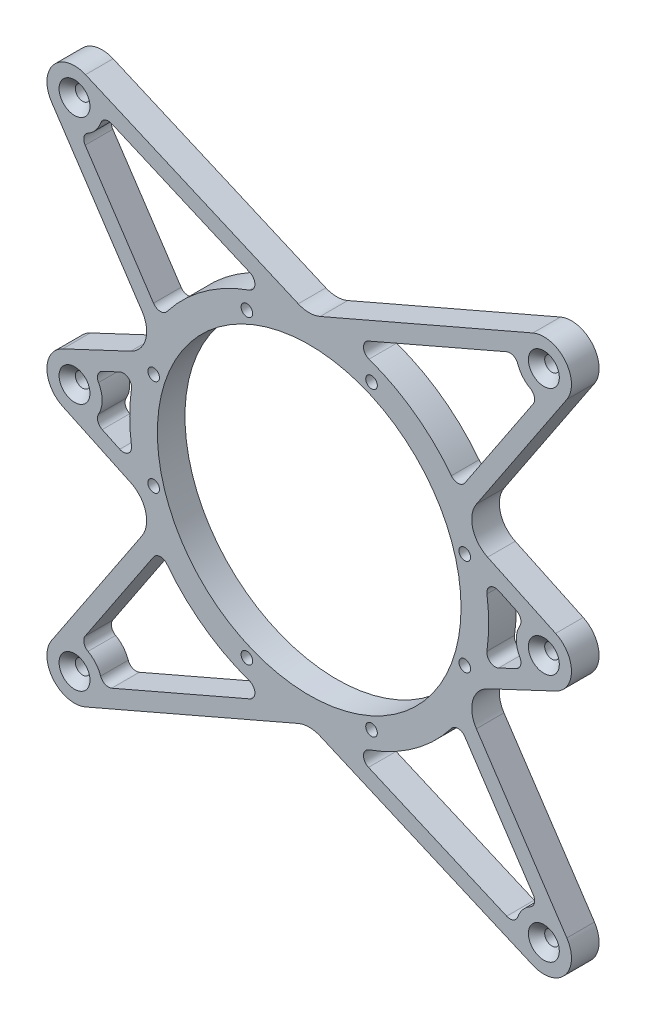
from build123d import *

# Parameters (mm, degrees)
SKETCH_1_R                   = 55
SKETCH_1_R_2                 = 2.6
SKETCH_1_R_3                 = 2.1
EXTRUDE_1_DEPTH              = 10
EXTRUDE_START                = -10
SKETCH_2_R                   = 2.6
EXTRUDE_3_DEPTH              = 10
CUT_EXTRUDE_1_DEPTH          = 30
FILLET_1_R                   = 3
HOLE_WIZARD_M5_1_D           = 5.3
HOLE_WIZARD_M5_1_DEPTH       = 22.4
HOLE_WIZARD_M5_1_CSINK_D     = 11.2
HOLE_WIZARD_M5_1_CSINK_ANGLE = 90
HOLE_WIZARD_M5_1_TIP         = 1.59228064
HOLE_WIZARD_M5_2_D           = 5.3
HOLE_WIZARD_M5_2_DEPTH       = 22.4
HOLE_WIZARD_M5_2_CSINK_D     = 11.2
HOLE_WIZARD_M5_2_CSINK_ANGLE = 90
HOLE_WIZARD_M5_2_TIP         = 1.59228064


with BuildPart() as part:
    # 草图1 → 凸台-拉伸1 (new body)
    with BuildSketch(Plane.XY):
        with BuildLine():
            ThreePointArc((-80.637921085, 94.119741198), (-89.119741198, 94.362078915), (-89.362078915, 85.880258802))
            Line((-89.362078915, 85.880258802), (-48.802059886, 42.9343563))
            ThreePointArc((-48.802059886, 42.9343563), (-59.690805099, 25.729511978), (-64.722484501, 6))
            Line((-64.722484501, 6), (-85, 6))
            ThreePointArc((-85, 6), (-91, 0), (-85, -6))
            Line((-85, -6), (-64.722484501, -6))
            ThreePointArc((-64.722484501, -6), (-59.690805099, -25.729511978), (-48.802059886, -42.9343563))
            Line((-48.802059886, -42.9343563), (-89.362078915, -85.880258802))
            ThreePointArc((-89.362078915, -85.880258802), (-89.119741198, -94.362078915), (-80.637921085, -94.119741198))
            Line((-80.637921085, -94.119741198), (-40.077902055, -51.173838696))
            ThreePointArc((-40.077902055, -51.173838696), (0, -65), (40.077902055, -51.173838696))
            Line((40.077902055, -51.173838696), (80.637921085, -94.119741198))
            ThreePointArc((80.637921085, -94.119741198), (89.119741198, -94.362078915), (89.362078915, -85.880258802))
            Line((89.362078915, -85.880258802), (48.802059886, -42.9343563))
            ThreePointArc((48.802059886, -42.9343563), (59.690805099, -25.729511978), (64.722484501, -6))
            Line((64.722484501, -6), (85, -6))
            ThreePointArc((85, -6), (91, 0), (85, 6))
            Line((85, 6), (64.722484501, 6))
            ThreePointArc((64.722484501, 6), (59.690805099, 25.729511978), (48.802059886, 42.9343563))
            Line((48.802059886, 42.9343563), (89.362078915, 85.880258802))
            ThreePointArc((89.362078915, 85.880258802), (89.119741198, 94.362078915), (80.637921085, 94.119741198))
            Line((80.637921085, 94.119741198), (40.077902055, 51.173838696))
            ThreePointArc((40.077902055, 51.173838696), (0, 65), (-40.077902055, 51.173838696))
            Line((-40.077902055, 51.173838696), (-80.637921085, 94.119741198))
        make_face()
        Circle(SKETCH_1_R, mode=Mode.SUBTRACT)
        with Locations((-85, 90)):
            Circle(SKETCH_1_R_2, mode=Mode.SUBTRACT)
        with Locations((-56.344919913, 17.5)):
            Circle(SKETCH_1_R_3, mode=Mode.SUBTRACT)
        with Locations((22.57832251, 54.508892418)):
            Circle(SKETCH_1_R_3, mode=Mode.SUBTRACT)
        with Locations((-22.57832251, 54.508892418)):
            Circle(SKETCH_1_R_3, mode=Mode.SUBTRACT)
        with Locations((-85, 0)):
            Circle(SKETCH_1_R_2, mode=Mode.SUBTRACT)
        with Locations((-56.344919913, -17.5)):
            Circle(SKETCH_1_R_3, mode=Mode.SUBTRACT)
        with Locations((85, 90)):
            Circle(SKETCH_1_R_2, mode=Mode.SUBTRACT)
        with Locations((56.344919913, 17.5)):
            Circle(SKETCH_1_R_3, mode=Mode.SUBTRACT)
        with Locations((-85, -90)):
            Circle(SKETCH_1_R_2, mode=Mode.SUBTRACT)
        with Locations((22.57832251, -54.508892418)):
            Circle(SKETCH_1_R_3, mode=Mode.SUBTRACT)
        with Locations((-22.57832251, -54.508892418)):
            Circle(SKETCH_1_R_3, mode=Mode.SUBTRACT)
        with Locations((85, 0)):
            Circle(SKETCH_1_R_2, mode=Mode.SUBTRACT)
        with Locations((56.344919913, -17.5)):
            Circle(SKETCH_1_R_3, mode=Mode.SUBTRACT)
        with Locations((85, -90)):
            Circle(SKETCH_1_R_2, mode=Mode.SUBTRACT)
    extrude(amount=EXTRUDE_1_DEPTH)

    # 草图2 → 凸台-拉伸3 (add)
    # profile 1 of 24: a face of its own
    with BuildSketch(Plane.XY.offset(10).offset(EXTRUDE_START)):
        with BuildLine():
            Line((-3.97243513, 65.822867597), (-81.02756487, 99.177132403))
            ThreePointArc((-81.02756487, 99.177132403), (-76.641640373, 95.489792742), (-75, 90))
            ThreePointArc((-75, 90), (-75.036299086, 89.148727949), (-75.144932821, 88.303635977))
            Line((-75.144932821, 88.303635977), (-40.077902055, 51.173838696))
            ThreePointArc((-40.077902055, 51.173838696), (-21.197882984, 61.446316057), (-3.1e-08, 65))
            ThreePointArc((-3.1e-08, 65), (-2.028383111, 65.207877556), (-3.97243513, 65.822867597))
        make_face()
    # profile 2 of 24: a face of its own
    with BuildSketch(Plane.XY.offset(10).offset(EXTRUDE_START)):
        with BuildLine():
            ThreePointArc((3.97243513, 65.822867597), (2.028383081, 65.20787755), (-3.1e-08, 65))
            ThreePointArc((-3.1e-08, 65), (21.197882955, 61.446316067), (40.077902055, 51.173838696))
            Line((40.077902055, 51.173838696), (75.144932821, 88.303635977))
            ThreePointArc((75.144932821, 88.303635977), (76.204649742, 94.758341502), (81.02756487, 99.177132403))
            Line((81.02756487, 99.177132403), (3.97243513, 65.822867597))
        make_face()
    # profile 3 of 24: a face of its own
    with BuildSketch(Plane.XY.offset(10).offset(EXTRUDE_START)):
        with BuildLine():
            ThreePointArc((-83.869090652, 80.064153582), (-89.214676132, 80.931565455), (-93.324194568, 84.458539471))
            Line((-93.324194568, 84.458539471), (-60.550698091, 35.22730162))
            ThreePointArc((-60.550698091, 35.22730162), (-59.303008161, 32.58049602), (-58.874892659, 29.685841091))
            ThreePointArc((-58.874892659, 29.685841091), (-59.081190839, 27.665097497), (-59.691573593, 25.727729049))
            ThreePointArc((-59.691573593, 25.727729049), (-54.924804339, 34.760118934), (-48.802059886, 42.9343563))
            Line((-48.802059886, 42.9343563), (-83.869090652, 80.064153582))
        make_face()
    # profile 4 of 24: a face of its own
    with BuildSketch(Plane.XY.offset(10).offset(EXTRUDE_START)):
        with BuildLine():
            ThreePointArc((-75, 90), (-76.641640373, 95.489792742), (-81.02756487, 99.177132403))
            ThreePointArc((-81.02756487, 99.177132403), (-92.674222894, 96.411419732), (-93.324194568, 84.458539471))
            ThreePointArc((-93.324194568, 84.458539471), (-89.214676132, 80.931565455), (-83.869090652, 80.064153582))
            Line((-83.869090652, 80.064153582), (-89.362078915, 85.880258802))
            ThreePointArc((-89.362078915, 85.880258802), (-89.119741198, 94.362078915), (-80.637921085, 94.119741198))
            Line((-80.637921085, 94.119741198), (-75.144932821, 88.303635977))
            ThreePointArc((-75.144932821, 88.303635977), (-75.036299086, 89.148727949), (-75, 90))
        make_face()
    # profile 5 of 24: a face of its own
    with BuildSketch(Plane.XY.offset(10).offset(EXTRUDE_START)):
        with BuildLine():
            ThreePointArc((-83.869090652, 80.064153582), (-78.13376467, 82.729868475), (-75.144932821, 88.303635977))
            Line((-75.144932821, 88.303635977), (-80.637921085, 94.119741198))
            ThreePointArc((-80.637921085, 94.119741198), (-89.119741198, 94.362078915), (-89.362078915, 85.880258802))
            Line((-89.362078915, 85.880258802), (-83.869090652, 80.064153582))
        make_face()
        with Locations((-85, 90)):
            Circle(SKETCH_2_R, mode=Mode.SUBTRACT)
    # profile 6 of 24: a face of its own
    with BuildSketch(Plane.XY.offset(10).offset(EXTRUDE_START)):
        with BuildLine():
            ThreePointArc((-59.691573593, 25.727729049), (-61.689227382, 22.731258822), (-64.618822759, 20.636759977))
            Line((-64.618822759, 20.636759977), (-89.256069899, 9.049081114))
            ThreePointArc((-89.256069899, 9.049081114), (-82.585776096, 9.704201304), (-77, 6))
            Line((-77, 6), (-64.722484501, 6))
            ThreePointArc((-64.722484501, 6), (-62.984206641, 16.062058206), (-59.691573593, 25.727729049))
        make_face()
    # profile 7 of 24: a face of its own
    with BuildSketch(Plane.XY.offset(10).offset(EXTRUDE_START)):
        with BuildLine():
            ThreePointArc((-77, -6), (-82.585776096, -9.704201304), (-89.256069899, -9.049081114))
            Line((-89.256069899, -9.049081114), (-64.618822759, -20.636759977))
            ThreePointArc((-64.618822759, -20.636759977), (-61.689227425, -22.731258778), (-59.691573641, -25.727728936))
            ThreePointArc((-59.691573641, -25.727728936), (-62.984206656, -16.062058146), (-64.722484501, -6))
            Line((-64.722484501, -6), (-77, -6))
        make_face()
    # profile 8 of 24: a face of its own
    with BuildSketch(Plane.XY.offset(10).offset(EXTRUDE_START)):
        with BuildLine():
            ThreePointArc((-77, 6), (-82.585776096, 9.704201304), (-89.256069899, 9.049081114))
            ThreePointArc((-89.256069899, 9.049081114), (-95, 0), (-89.256069899, -9.049081114))
            ThreePointArc((-89.256069899, -9.049081114), (-82.585776096, -9.704201304), (-77, -6))
            Line((-77, -6), (-85, -6))
            ThreePointArc((-85, -6), (-91, 0), (-85, 6))
            Line((-85, 6), (-77, 6))
        make_face()
    # profile 9 of 24: a face of its own
    with BuildSketch(Plane.XY.offset(10).offset(EXTRUDE_START)):
        with BuildLine():
            ThreePointArc((-75, 0), (-75.513167019, 3.16227766), (-77, 6))
            Line((-77, 6), (-85, 6))
            ThreePointArc((-85, 6), (-91, 0), (-85, -6))
            Line((-85, -6), (-77, -6))
            ThreePointArc((-77, -6), (-75.513167019, -3.16227766), (-75, 0))
        make_face()
        with Locations((-85, 0)):
            Circle(SKETCH_2_R, mode=Mode.SUBTRACT)
    # profile 10 of 24: a face of its own
    with BuildSketch(Plane.XY.offset(10).offset(EXTRUDE_START)):
        with BuildLine():
            ThreePointArc((-58.874892659, -29.685841091), (-59.303008161, -32.58049602), (-60.550698091, -35.22730162))
            Line((-60.550698091, -35.22730162), (-93.324194568, -84.458539471))
            ThreePointArc((-93.324194568, -84.458539471), (-89.214676132, -80.931565455), (-83.869090652, -80.064153582))
            Line((-83.869090652, -80.064153582), (-48.802059886, -42.9343563))
            ThreePointArc((-48.802059886, -42.9343563), (-54.924804372, -34.760118882), (-59.691573641, -25.727728936))
            ThreePointArc((-59.691573641, -25.727728936), (-59.081190851, -27.665097437), (-58.874892659, -29.685841091))
        make_face()
    # profile 11 of 24: a face of its own
    with BuildSketch(Plane.XY.offset(10).offset(EXTRUDE_START)):
        with BuildLine():
            ThreePointArc((-83.869090652, -80.064153582), (-89.214676132, -80.931565455), (-93.324194568, -84.458539471))
            ThreePointArc((-93.324194568, -84.458539471), (-92.674222894, -96.411419732), (-81.02756487, -99.177132403))
            ThreePointArc((-81.02756487, -99.177132403), (-76.641640373, -95.489792742), (-75, -90))
            ThreePointArc((-75, -90), (-75.036299086, -89.148727949), (-75.144932821, -88.303635977))
            Line((-75.144932821, -88.303635977), (-80.637921085, -94.119741198))
            ThreePointArc((-80.637921085, -94.119741198), (-89.119741198, -94.362078915), (-89.362078915, -85.880258802))
            Line((-89.362078915, -85.880258802), (-83.869090652, -80.064153582))
        make_face()
    # profile 12 of 24: a face of its own
    with BuildSketch(Plane.XY.offset(10).offset(EXTRUDE_START)):
        with BuildLine():
            ThreePointArc((-75.144932821, -88.303635977), (-78.13376467, -82.729868475), (-83.869090652, -80.064153582))
            Line((-83.869090652, -80.064153582), (-89.362078915, -85.880258802))
            ThreePointArc((-89.362078915, -85.880258802), (-89.119741198, -94.362078915), (-80.637921085, -94.119741198))
            Line((-80.637921085, -94.119741198), (-75.144932821, -88.303635977))
        make_face()
        with Locations((-85, -90)):
            Circle(SKETCH_2_R, mode=Mode.SUBTRACT)
    # profile 13 of 24: a face of its own
    with BuildSketch(Plane.XY.offset(10).offset(EXTRUDE_START)):
        with BuildLine():
            ThreePointArc((-75, -90), (-76.641640373, -95.489792742), (-81.02756487, -99.177132403))
            Line((-81.02756487, -99.177132403), (-3.97243513, -65.822867597))
            ThreePointArc((-3.97243513, -65.822867597), (-2.028383123, -65.207877559), (-5.3e-08, -65))
            ThreePointArc((-5.3e-08, -65), (-21.197882995, -61.446316053), (-40.077902055, -51.173838696))
            Line((-40.077902055, -51.173838696), (-75.144932821, -88.303635977))
            ThreePointArc((-75.144932821, -88.303635977), (-75.036299086, -89.148727949), (-75, -90))
        make_face()
    # profile 14 of 24: a face of its own
    with BuildSketch(Plane.XY.offset(10).offset(EXTRUDE_START)):
        with BuildLine():
            ThreePointArc((40.077902055, -51.173838696), (21.197882944, -61.446316071), (-5.3e-08, -65))
            ThreePointArc((-5.3e-08, -65), (2.02838307, -65.207877548), (3.97243513, -65.822867597))
            Line((3.97243513, -65.822867597), (81.02756487, -99.177132403))
            ThreePointArc((81.02756487, -99.177132403), (76.204649742, -94.758341502), (75.144932821, -88.303635977))
            Line((75.144932821, -88.303635977), (40.077902055, -51.173838696))
        make_face()
    # profile 15 of 24: a face of its own
    with BuildSketch(Plane.XY.offset(10).offset(EXTRUDE_START)):
        with BuildLine():
            ThreePointArc((75.144932821, -88.303635977), (76.204649742, -94.758341502), (81.02756487, -99.177132403))
            ThreePointArc((81.02756487, -99.177132403), (90.489792742, -98.358359627), (95, -90))
            ThreePointArc((95, -90), (94.571884498, -87.105345071), (93.324194568, -84.458539471))
            ThreePointArc((93.324194568, -84.458539471), (89.214676132, -80.931565455), (83.869090652, -80.064153582))
            Line((83.869090652, -80.064153582), (89.362078915, -85.880258802))
            ThreePointArc((89.362078915, -85.880258802), (89.119741198, -94.362078915), (80.637921085, -94.119741198))
            Line((80.637921085, -94.119741198), (75.144932821, -88.303635977))
        make_face()
    # profile 16 of 24: a face of its own
    with BuildSketch(Plane.XY.offset(10).offset(EXTRUDE_START)):
        with BuildLine():
            ThreePointArc((83.869090652, -80.064153582), (78.13376467, -82.729868475), (75.144932821, -88.303635977))
            Line((75.144932821, -88.303635977), (80.637921085, -94.119741198))
            ThreePointArc((80.637921085, -94.119741198), (89.119741198, -94.362078915), (89.362078915, -85.880258802))
            Line((89.362078915, -85.880258802), (83.869090652, -80.064153582))
        make_face()
        with Locations((85, -90)):
            Circle(SKETCH_2_R, mode=Mode.SUBTRACT)
    # profile 17 of 24: a face of its own
    with BuildSketch(Plane.XY.offset(10).offset(EXTRUDE_START)):
        with BuildLine():
            ThreePointArc((60.550698091, -35.22730162), (58.915538859, -30.586547422), (59.691573565, -25.727729112))
            ThreePointArc((59.691573565, -25.727729112), (54.924804321, -34.760118963), (48.802059886, -42.9343563))
            Line((48.802059886, -42.9343563), (83.869090652, -80.064153582))
            ThreePointArc((83.869090652, -80.064153582), (89.214676132, -80.931565455), (93.324194568, -84.458539471))
            Line((93.324194568, -84.458539471), (60.550698091, -35.22730162))
        make_face()
    # profile 18 of 24: a face of its own
    with BuildSketch(Plane.XY.offset(10).offset(EXTRUDE_START)):
        with BuildLine():
            ThreePointArc((89.256069899, -9.049081114), (82.585776096, -9.704201304), (77, -6))
            Line((77, -6), (64.722484501, -6))
            ThreePointArc((64.722484501, -6), (62.984206633, -16.062058239), (59.691573565, -25.727729112))
            ThreePointArc((59.691573565, -25.727729112), (61.689227358, -22.731258847), (64.618822759, -20.636759977))
            Line((64.618822759, -20.636759977), (89.256069899, -9.049081114))
        make_face()
    # profile 19 of 24: a face of its own
    with BuildSketch(Plane.XY.offset(10).offset(EXTRUDE_START)):
        with BuildLine():
            ThreePointArc((95, 0), (93.442769066, 5.359071795), (89.256069899, 9.049081114))
            ThreePointArc((89.256069899, 9.049081114), (82.585776096, 9.704201304), (77, 6))
            Line((77, 6), (85, 6))
            ThreePointArc((85, 6), (91, 0), (85, -6))
            Line((85, -6), (77, -6))
            ThreePointArc((77, -6), (82.585776096, -9.704201304), (89.256069899, -9.049081114))
            ThreePointArc((89.256069899, -9.049081114), (93.442769066, -5.359071795), (95, 0))
        make_face()
    # profile 20 of 24: a face of its own
    with BuildSketch(Plane.XY.offset(10).offset(EXTRUDE_START)):
        with BuildLine():
            Line((85, 6), (77, 6))
            ThreePointArc((77, 6), (75, 0), (77, -6))
            Line((77, -6), (85, -6))
            ThreePointArc((85, -6), (91, 0), (85, 6))
        make_face()
        with Locations((85, 0)):
            Circle(SKETCH_2_R, mode=Mode.SUBTRACT)
    # profile 21 of 24: a face of its own
    with BuildSketch(Plane.XY.offset(10).offset(EXTRUDE_START)):
        with BuildLine():
            ThreePointArc((64.618822759, 20.636759977), (61.689227404, 22.7312588), (59.691573617, 25.727728993))
            ThreePointArc((59.691573617, 25.727728993), (62.984206649, 16.062058176), (64.722484501, 6))
            Line((64.722484501, 6), (77, 6))
            ThreePointArc((77, 6), (82.585776096, 9.704201304), (89.256069899, 9.049081114))
            Line((89.256069899, 9.049081114), (64.618822759, 20.636759977))
        make_face()
    # profile 22 of 24: a face of its own
    with BuildSketch(Plane.XY.offset(10).offset(EXTRUDE_START)):
        with BuildLine():
            ThreePointArc((93.324194568, 84.458539471), (89.214676132, 80.931565455), (83.869090652, 80.064153582))
            Line((83.869090652, 80.064153582), (48.802059886, 42.9343563))
            ThreePointArc((48.802059886, 42.9343563), (54.924804355, 34.760118908), (59.691573617, 25.727728993))
            ThreePointArc((59.691573617, 25.727728993), (58.915538853, 30.586547358), (60.550698091, 35.22730162))
            Line((60.550698091, 35.22730162), (93.324194568, 84.458539471))
        make_face()
    # profile 23 of 24: a face of its own
    with BuildSketch(Plane.XY.offset(10).offset(EXTRUDE_START)):
        with BuildLine():
            ThreePointArc((95, 90), (90.489792742, 98.358359627), (81.02756487, 99.177132403))
            ThreePointArc((81.02756487, 99.177132403), (76.204649742, 94.758341502), (75.144932821, 88.303635977))
            Line((75.144932821, 88.303635977), (80.637921085, 94.119741198))
            ThreePointArc((80.637921085, 94.119741198), (89.119741198, 94.362078915), (89.362078915, 85.880258802))
            Line((89.362078915, 85.880258802), (83.869090652, 80.064153582))
            ThreePointArc((83.869090652, 80.064153582), (89.214676132, 80.931565455), (93.324194568, 84.458539471))
            ThreePointArc((93.324194568, 84.458539471), (94.571884498, 87.105345071), (95, 90))
        make_face()
    # profile 24 of 24: a face of its own
    with BuildSketch(Plane.XY.offset(10).offset(EXTRUDE_START)):
        with BuildLine():
            Line((80.637921085, 94.119741198), (75.144932821, 88.303635977))
            ThreePointArc((75.144932821, 88.303635977), (78.13376467, 82.729868475), (83.869090652, 80.064153582))
            Line((83.869090652, 80.064153582), (89.362078915, 85.880258802))
            ThreePointArc((89.362078915, 85.880258802), (89.119741198, 94.362078915), (80.637921085, 94.119741198))
        make_face()
        with Locations((85, 90)):
            Circle(SKETCH_2_R, mode=Mode.SUBTRACT)
    extrude(amount=EXTRUDE_3_DEPTH)

    # 草图3 → 切除-拉伸1 (cut)
    with BuildSketch(Plane(origin=(0, 0, 0), x_dir=(-1, 0, 0), z_dir=(0, 0, -1))):
        with BuildLine():
            ThreePointArc((-54.152638624, 35.951241009), (-36.652270318, 53.680639718), (-13.768186923, 63.525089759))
            Line((-13.768186923, 63.525089759), (-75.000045168, 90.030056026))
            ThreePointArc((-75.000045168, 90.030056026), (-75.000011292, 90.01502803), (-75, 90))
            ThreePointArc((-75, 90), (-77.335420873, 83.577054663), (-83.25084536, 80.154165447))
            Line((-83.25084536, 80.154165447), (-55.55618135, 38.552177937))
            ThreePointArc((-55.55618135, 38.552177937), (-54.794226745, 37.284186136), (-54.152638624, 35.951241009))
        make_face()
        with BuildLine():
            ThreePointArc((-63.336978952, -14.609144303), (-65, 0), (-63.336978952, 14.609144303))
            Line((-63.336978952, 14.609144303), (-78.408808124, 7.520384941))
            ThreePointArc((-78.408808124, 7.520384941), (-75.891983785, 4.128442881), (-75, 0))
            ThreePointArc((-75, 0), (-75.891983785, -4.128442881), (-78.408808124, -7.520384941))
            Line((-78.408808124, -7.520384941), (-63.336978952, -14.609144303))
        make_face()
        with BuildLine():
            ThreePointArc((-13.768186923, -63.525089759), (-36.652270318, -53.680639718), (-54.152638624, -35.951241009))
            ThreePointArc((-54.152638624, -35.951241009), (-54.794226745, -37.284186136), (-55.55618135, -38.552177937))
            Line((-55.55618135, -38.552177937), (-83.25084536, -80.154165447))
            ThreePointArc((-83.25084536, -80.154165447), (-77.335420873, -83.577054663), (-75, -90))
            ThreePointArc((-75, -90), (-75.000011292, -90.01502803), (-75.000045168, -90.030056026))
            Line((-75.000045168, -90.030056026), (-13.768186923, -63.525089759))
        make_face()
        with BuildLine():
            ThreePointArc((55.55618135, -38.552177937), (54.794226745, -37.284186136), (54.152638624, -35.951241009))
            ThreePointArc((54.152638624, -35.951241009), (36.652270318, -53.680639718), (13.768186923, -63.525089759))
            Line((13.768186923, -63.525089759), (75.000045168, -90.030056026))
            ThreePointArc((75.000045168, -90.030056026), (77.325777106, -83.588580268), (83.25084536, -80.154165447))
            Line((83.25084536, -80.154165447), (55.55618135, -38.552177937))
        make_face()
        with BuildLine():
            Line((78.408808124, 7.520384941), (63.336978952, 14.609144303))
            ThreePointArc((63.336978952, 14.609144303), (64.582906531, 7.351747008), (65, 0))
            ThreePointArc((65, 0), (64.582906531, -7.351747008), (63.336978952, -14.609144303))
            Line((63.336978952, -14.609144303), (78.408808124, -7.520384941))
            ThreePointArc((78.408808124, -7.520384941), (75, 0), (78.408808124, 7.520384941))
        make_face()
        with BuildLine():
            Line((75.000045168, 90.030056026), (13.768186923, 63.525089759))
            ThreePointArc((13.768186923, 63.525089759), (36.652270318, 53.680639718), (54.152638624, 35.951241009))
            ThreePointArc((54.152638624, 35.951241009), (54.794226745, 37.284186136), (55.55618135, 38.552177937))
            Line((55.55618135, 38.552177937), (83.25084536, 80.154165447))
            ThreePointArc((83.25084536, 80.154165447), (77.325777106, 83.588580268), (75.000045168, 90.030056026))
        make_face()
    extrude(amount=-CUT_EXTRUDE_1_DEPTH, mode=Mode.SUBTRACT)

    # 圆角1
    fillet_1_edges = [part.edges().sort_by_distance(p)[0] for p in [
        (-75.000045168, 90.030056026, 5),
        (-83.25084536, 80.154165447, 5),
        (-54.152638624, 35.951241009, 5),
        (-78.408808124, 7.520384941, 5),
        (-78.408808124, -7.520384941, 5),
        (-63.336978952, -14.609144303, 5),
        (-63.336978952, 14.609144303, 5),
        (-83.25084536, -80.154165447, 5),
        (-75.000045168, -90.030056026, 5),
        (-13.768186923, -63.525089759, 5),
        (-54.152638624, -35.951241009, 5),
        (13.768186923, -63.525089759, 5),
        (75.000045168, -90.030056026, 5),
        (83.25084536, -80.154165447, 5),
        (54.152638624, -35.951241009, 5),
        (78.408808124, -7.520384941, 5),
        (78.408808124, 7.520384941, 5),
        (63.336978952, 14.609144303, 5),
        (63.336978952, -14.609144303, 5),
        (83.25084536, 80.154165447, 5),
        (75.000045168, 90.030056026, 5),
        (13.768186923, 63.525089759, 5),
        (54.152638624, 35.951241009, 5),
        (-13.768186923, 63.525089759, 5),
    ]]
    fillet(fillet_1_edges, radius=FILLET_1_R)

    # M5 开槽半沉头木螺钉的锥形沉头孔1
    with Locations(Plane(origin=(-85, 90, 10), x_dir=(1, 0, 0), z_dir=(0, 0, 1))):
        with Locations((0, 0), (170, 0), (170, -90), (0, -90)):
            CounterSinkHole(HOLE_WIZARD_M5_1_D / 2, HOLE_WIZARD_M5_1_CSINK_D / 2, depth=HOLE_WIZARD_M5_1_DEPTH, counter_sink_angle=HOLE_WIZARD_M5_1_CSINK_ANGLE)
            with Locations((0, 0, -(HOLE_WIZARD_M5_1_DEPTH + HOLE_WIZARD_M5_1_TIP / 2))):  # 118° drill point
                Cone(0, HOLE_WIZARD_M5_1_D / 2, HOLE_WIZARD_M5_1_TIP, mode=Mode.SUBTRACT)

    # M5 开槽半沉头木螺钉的锥形沉头孔2
    with Locations(Plane.XY.offset(10)):
        with Locations((-85, -90), (85, -90)):
            CounterSinkHole(HOLE_WIZARD_M5_2_D / 2, HOLE_WIZARD_M5_2_CSINK_D / 2, depth=HOLE_WIZARD_M5_2_DEPTH, counter_sink_angle=HOLE_WIZARD_M5_2_CSINK_ANGLE)
            with Locations((0, 0, -(HOLE_WIZARD_M5_2_DEPTH + HOLE_WIZARD_M5_2_TIP / 2))):  # 118° drill point
                Cone(0, HOLE_WIZARD_M5_2_D / 2, HOLE_WIZARD_M5_2_TIP, mode=Mode.SUBTRACT)


solid = part.part
